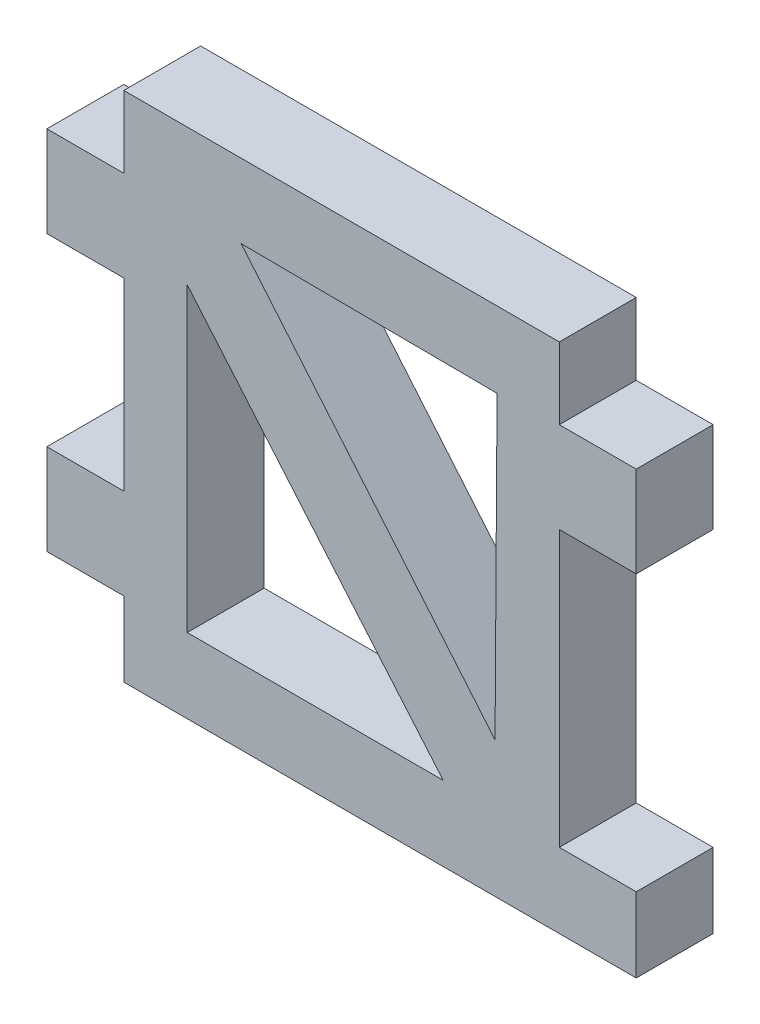
from build123d import *

# Parameters (mm, degrees)
EXTRUDE_1_DEPTH = 10


with BuildPart() as part:
    # 草图1 → 凸台-拉伸1 (new body)
    with BuildSketch(Plane.XY):
        Polygon((-28.32, 23.992), (-38.32, 23.992), (-38.32, 12.192), (-28.32, 12.192), (-28.32, -11.808), (-38.32, -11.808), (-38.32, -23.608), (-28.32, -23.608), (-28.32, -33.32), (28.32, -33.32), (38.32, -33.32), (38.32, -23.608), (28.32, -23.608), (28.32, 12.192), (38.32, 12.192), (38.32, 23.992), (28.32, 23.992), (28.32, 33.32), (-28.32, 33.32), align=None)
        Polygon((-20.065382953, 15.549088882), (13.215792231, -23.608), (-20.065382953, -23.608), align=None, mode=Mode.SUBTRACT)
        Polygon((19.961624404, -15.682069675), (-13.058637611, 23.695290925), (20.221802898, 23.474154822), align=None, mode=Mode.SUBTRACT)
    extrude(amount=EXTRUDE_1_DEPTH)


solid = part.part
